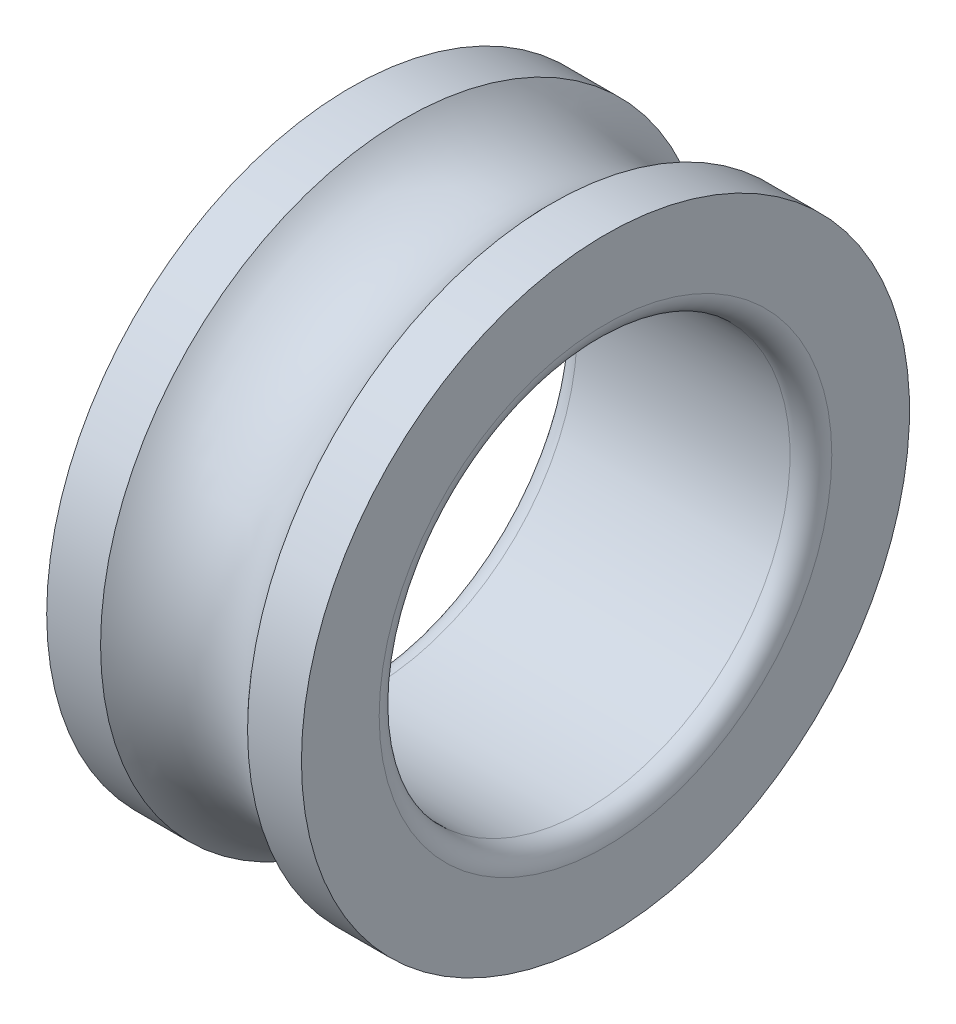
from build123d import *

# Parameters (mm, degrees)
SCALE1_SCALE = 0.07


with BuildPart() as part:
    # Sketch1 → Revolve1 (revolve)
    with BuildSketch(Plane.XY, mode=Mode.PRIVATE) as revolve1_sk:
        with BuildLine():
            Line((-15.5, 37), (-8.94427191, 37))
            ThreePointArc((-8.94427191, 37), (0, 33), (8.94427191, 37))
            Line((8.94427191, 37), (15.5, 37))
            Line((15.5, 37), (15.5, 27.54))
            ThreePointArc((15.5, 27.54), (14.756051224, 25.743948776), (12.96, 25))
            Line((12.96, 25), (-12.96, 25))
            ThreePointArc((-12.96, 25), (-14.756051224, 25.743948776), (-15.5, 27.54))
            Line((-15.5, 27.54), (-15.5, 37))
        make_face()
    revolve(revolve1_sk.sketch.rotate(Axis((-21.666666667, 0, 0), (1, 0, 0)), 90), axis=Axis((-21.666666667, 0, 0), (1, 0, 0)))


with BuildPart() as part_1:
    # Scale1: scaled about (0, 0, 0)
    add(part.part.scale(SCALE1_SCALE))


solid = part_1.part
